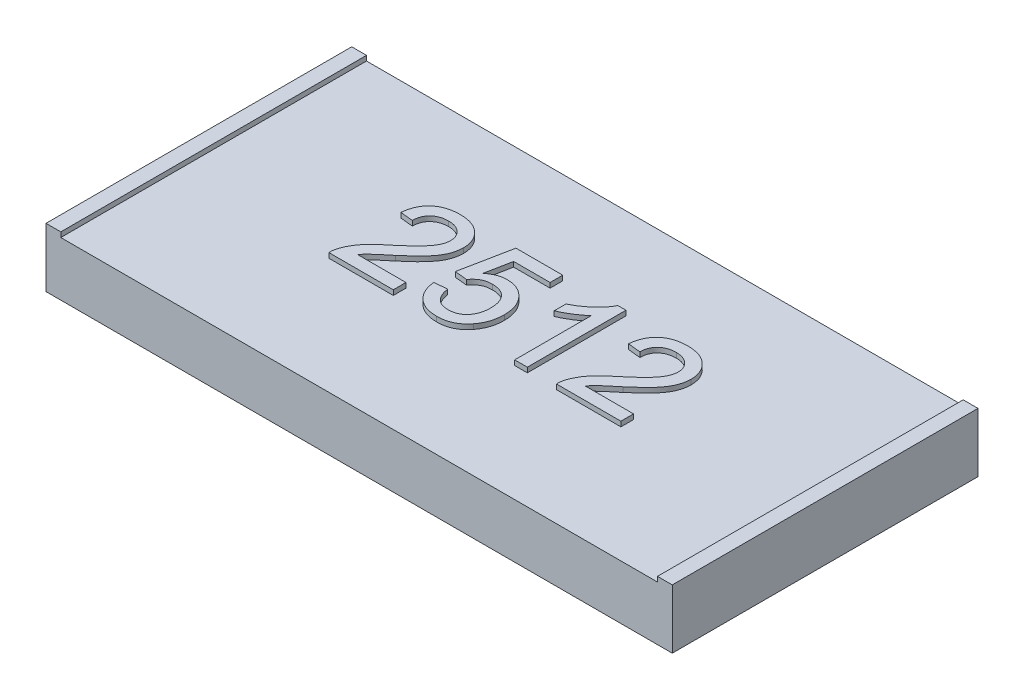
from build123d import *

# Parameters (mm, degrees)
SKETCH_1_W      = 6.35
SKETCH_1_H      = 3.1
EXTRUDE_1_DEPTH = 0.55
SKETCH_2_W      = 0.15
SKETCH_2_H      = 3.1
EXTRUDE_2_DEPTH = 0.05
EXTRUDE_3_DEPTH = 0.05


with BuildPart() as part:
    # Эскиз1 → Бобышка-Вытянуть1 (new body)
    with BuildSketch(Plane(origin=(0, 0, 0), x_dir=(1, 0, 0), z_dir=(0, 1, 0))):
        Rectangle(SKETCH_1_W, SKETCH_1_H)
    extrude(amount=EXTRUDE_1_DEPTH)

    # Эскиз2 → Бобышка-Вытянуть2 (add)
    with BuildSketch(Plane(origin=(0, 0.55, 0), x_dir=(1, 0, 0), z_dir=(0, 1, 0))):
        with Locations((-3.1, 0)):
            Rectangle(SKETCH_2_W, SKETCH_2_H)
        with Locations((3.1, 0)):
            Rectangle(SKETCH_2_W, SKETCH_2_H)
    extrude(amount=EXTRUDE_2_DEPTH)

    # Эскиз3 → Бобышка-Вытянуть3 (add)
    with BuildSketch(Plane(origin=(0, 0.55, 0), x_dir=(1, 0, 0), z_dir=(0, 1, 0))):
        with BuildLine():
            Line((-0.830578311, -0.244666445), (-0.830578311, -0.372871573))
            Line((-0.830578311, -0.372871573), (-1.484424464, -0.372871573))
            add(Edge.make_bspline(
                [(-1.484424464, -0.372871573), (-1.48443785, -0.365251982), (-1.484464577, -0.350038338), (-1.481890184, -0.327538325), (-1.477858168, -0.305336793), (-1.47329917, -0.291099834), (-1.47100299, -0.283929265)],
                knots=[0, 0, 0, 0, 1.01057331, 2.01775941, 3.001627217, 4, 4, 4, 4], degree=3))
            add(Edge.make_bspline(
                [(-1.47100299, -0.283929265), (-1.466760414, -0.272213411), (-1.458121831, -0.248358003), (-1.440619972, -0.21393798), (-1.420033649, -0.179726122), (-1.399989965, -0.15187284), (-1.38163428, -0.129620014), (-1.366240645, -0.112209754), (-1.349181676, -0.094388301), (-1.330471033, -0.07615891), (-1.310288797, -0.057403518), (-1.288607427, -0.038059575), (-1.265170902, -0.018487577), (-1.248809755, -0.005514443), (-1.24043408, 0.001126825)],
                knots=[0, 0, 0, 0, 1.204657718, 2.452881516, 3.728232997, 5.065887527, 5.768225529, 6.518857853, 7.313994055, 8.154655305, 9.046094665, 9.979688118, 10.965752482, 12, 12, 12, 12], degree=3))
            add(Edge.make_bspline(
                [(-1.24043408, 0.001126825), (-1.227566974, 0.011956859), (-1.202790545, 0.032810776), (-1.167802346, 0.063756057), (-1.135846321, 0.092490504), (-1.107431333, 0.119517745), (-1.082324979, 0.144575635), (-1.060468308, 0.167607401), (-1.041673258, 0.188541166), (-1.02616928, 0.208134644), (-1.013088098, 0.226636337), (-1.002002952, 0.244683596), (-0.992764953, 0.262591667), (-0.985070936, 0.280303884), (-0.978985623, 0.297895992), (-0.974837616, 0.315419246), (-0.972024581, 0.332699771), (-0.971743135, 0.344198425), (-0.971603952, 0.349884837)],
                knots=[0, 0, 0, 0, 1.782554561, 3.432421876, 4.950675607, 6.337395053, 7.588547463, 8.709982106, 9.702713005, 10.569305638, 11.356701089, 12.103210377, 12.812277205, 13.490692607, 14.148717897, 14.782152033, 15.397739362, 16, 16, 16, 16], degree=3))
            add(Edge.make_bspline(
                [(-0.971603952, 0.349884837), (-0.971743152, 0.355504903), (-0.972016255, 0.366531165), (-0.974607441, 0.38266803), (-0.978214581, 0.398208218), (-0.984046228, 0.412871969), (-0.990987644, 0.427093535), (-0.999891685, 0.440423533), (-1.01019183, 0.453194179), (-1.021984624, 0.465068773), (-1.034865118, 0.476209038), (-1.049257233, 0.485469304), (-1.064215701, 0.493806303), (-1.080256575, 0.500509728), (-1.097353791, 0.505432173), (-1.115382888, 0.5090046), (-1.134341005, 0.511269711), (-1.147278588, 0.511583382), (-1.153895618, 0.511743812)],
                knots=[0, 0, 0, 0, 0.988194508, 1.938783882, 2.870742509, 3.789494954, 4.709148727, 5.651055405, 6.603531303, 7.592354411, 8.592907906, 9.593461401, 10.59787167, 11.603930315, 12.645063138, 13.723588815, 14.835711238, 16, 16, 16, 16], degree=3))
            add(Edge.make_bspline(
                [(-1.153895618, 0.511743812), (-1.160846625, 0.511584177), (-1.174450255, 0.511271759), (-1.19433512, 0.508997615), (-1.213212352, 0.50552303), (-1.231036895, 0.500210688), (-1.247787053, 0.493518441), (-1.263394608, 0.485094684), (-1.278109501, 0.475585787), (-1.291468303, 0.464327969), (-1.303548492, 0.451845346), (-1.314272888, 0.438255545), (-1.323059919, 0.423296312), (-1.330316612, 0.407296566), (-1.3361516, 0.390206011), (-1.340387603, 0.371893993), (-1.3426971, 0.352413384), (-1.343161521, 0.339073068), (-1.343398823, 0.332256632)],
                knots=[0, 0, 0, 0, 1.131143733, 2.213731411, 3.253917892, 4.251203413, 5.236093891, 6.184197493, 7.13373276, 8.082770301, 9.020476205, 9.957489029, 10.893177274, 11.836722509, 12.812818608, 13.827831385, 14.890097571, 16, 16, 16, 16], degree=3))
            Line((-1.343398823, 0.332256632), (-1.471603952, 0.345077145))
            add(Edge.make_bspline(
                [(-1.471603952, 0.345077145), (-1.470292231, 0.356250535), (-1.467740392, 0.377987404), (-1.461384107, 0.409469597), (-1.45246046, 0.438757061), (-1.441782562, 0.466258125), (-1.428396812, 0.491504637), (-1.413265373, 0.515018794), (-1.395418539, 0.536054824), (-1.375702522, 0.555275814), (-1.353901312, 0.572214564), (-1.330219698, 0.587012914), (-1.304668512, 0.59939082), (-1.277390065, 0.60963921), (-1.248321733, 0.617414922), (-1.217504638, 0.62299084), (-1.18488922, 0.626427901), (-1.162517908, 0.626891586), (-1.151091131, 0.627128427)],
                knots=[0, 0, 0, 0, 1.130804643, 2.199883102, 3.223565206, 4.205909148, 5.160801384, 6.091796021, 7.01151579, 7.927798993, 8.855738875, 9.7815393, 10.730299821, 11.705391175, 12.706931101, 13.751121791, 14.851322166, 16, 16, 16, 16], degree=3))
            add(Edge.make_bspline(
                [(-1.151091131, 0.627128427), (-1.139527582, 0.626930414), (-1.117001719, 0.626544685), (-1.084177917, 0.622597894), (-1.053207753, 0.616450803), (-1.02397769, 0.607883641), (-0.996660425, 0.596649536), (-0.971234943, 0.582923997), (-0.947584014, 0.566840912), (-0.926102795, 0.548207214), (-0.906732619, 0.527865411), (-0.889757515, 0.506156322), (-0.875565512, 0.48317269), (-0.863481902, 0.459227795), (-0.854519043, 0.433815699), (-0.848216195, 0.407281885), (-0.843933227, 0.379603676), (-0.843579326, 0.360718772), (-0.843398823, 0.35108676)],
                knots=[0, 0, 0, 0, 1.195390245, 2.328627238, 3.413424916, 4.457841177, 5.473507151, 6.462241215, 7.441013641, 8.425227782, 9.397253344, 10.342087291, 11.269524934, 12.186751184, 13.110685745, 14.048630397, 15.004728144, 16, 16, 16, 16], degree=3))
            add(Edge.make_bspline(
                [(-0.843398823, 0.35108676), (-0.843674448, 0.34119096), (-0.844226306, 0.321377521), (-0.848533627, 0.291762274), (-0.855903502, 0.262468417), (-0.865673989, 0.233139428), (-0.879022508, 0.203658901), (-0.895886095, 0.173620152), (-0.916807217, 0.142912219), (-0.936927471, 0.116807065), (-0.955656162, 0.094924362), (-0.972257377, 0.07691362), (-0.991464021, 0.05777841), (-1.012555582, 0.036856037), (-1.036392276, 0.014889079), (-1.062289217, -0.008780277), (-1.090813304, -0.033529144), (-1.110614579, -0.050436382), (-1.120842734, -0.05916965)],
                knots=[0, 0, 0, 0, 0.927118007, 1.856282007, 2.79721255, 3.754929441, 4.749232485, 5.824981375, 6.979078785, 8.228161913, 8.911614355, 9.677694854, 10.522803217, 11.452009355, 12.461436787, 13.560019032, 14.739651695, 16, 16, 16, 16], degree=3))
            add(Edge.make_bspline(
                [(-1.120842734, -0.05916965), (-1.129601603, -0.066300304), (-1.14630342, -0.079897363), (-1.17006499, -0.099609383), (-1.191348129, -0.117684772), (-1.21065054, -0.133533945), (-1.227269243, -0.147923505), (-1.241789607, -0.160223253), (-1.2536841, -0.171051616), (-1.271797307, -0.187500117), (-1.294739229, -0.210945794), (-1.311643819, -0.233727303), (-1.319761003, -0.244666445)],
                knots=[0, 0, 0, 0, 1.241996727, 2.368296581, 3.394949853, 4.3125351, 5.114548721, 5.812230366, 6.404953749, 6.883082049, 8.503329734, 10, 10, 10, 10], degree=3))
            Line((-1.319761003, -0.244666445), (-0.830578311, -0.244666445))
        make_face()
        with BuildLine():
            Line((-0.68955267, -0.103640804), (-0.561347541, -0.090820291))
            add(Edge.make_bspline(
                [(-0.561347541, -0.090820291), (-0.560078109, -0.098043946), (-0.557608867, -0.112095079), (-0.552903452, -0.132434511), (-0.546792457, -0.151330412), (-0.539926082, -0.168946431), (-0.531764236, -0.185096301), (-0.522920809, -0.200035019), (-0.512491794, -0.213232309), (-0.501527086, -0.2253784), (-0.48949248, -0.236081254), (-0.476271852, -0.245104129), (-0.462234067, -0.252976041), (-0.447208149, -0.259421213), (-0.431171069, -0.26413874), (-0.414326937, -0.267869494), (-0.396458854, -0.269749403), (-0.384267583, -0.270119069), (-0.378054272, -0.27030747)],
                knots=[0, 0, 0, 0, 1.237781394, 2.407677316, 3.51963579, 4.58689595, 5.594855907, 6.570874, 7.510833816, 8.428091223, 9.330271693, 10.221190844, 11.124215526, 12.043132878, 12.973586933, 13.941700858, 14.950982896, 16, 16, 16, 16], degree=3))
            add(Edge.make_bspline(
                [(-0.378054272, -0.27030747), (-0.370431932, -0.270123292), (-0.355526113, -0.269763125), (-0.333840971, -0.26671697), (-0.313357598, -0.261694213), (-0.294174004, -0.254665238), (-0.276065298, -0.245923877), (-0.259632227, -0.234605406), (-0.243978767, -0.221882326), (-0.230112223, -0.206713973), (-0.217489772, -0.190200687), (-0.206595648, -0.172175733), (-0.197424335, -0.152892105), (-0.189703092, -0.132353501), (-0.184001517, -0.11044259), (-0.179807548, -0.087275935), (-0.177115188, -0.062838778), (-0.176861644, -0.046089223), (-0.176732157, -0.037535034)],
                knots=[0, 0, 0, 0, 1.052816602, 2.058828735, 3.018813999, 3.961574988, 4.877590722, 5.788574389, 6.712363302, 7.658909047, 8.620312049, 9.580784896, 10.562948504, 11.56722449, 12.607883026, 13.686460295, 14.818448981, 16, 16, 16, 16], degree=3))
            add(Edge.make_bspline(
                [(-0.176732157, -0.037535034), (-0.17687933, -0.029383005), (-0.177165911, -0.013509112), (-0.179579389, 0.009605915), (-0.18365121, 0.031341036), (-0.188919765, 0.051935809), (-0.196181803, 0.071068416), (-0.20479499, 0.089016261), (-0.215346506, 0.105398439), (-0.227085764, 0.120725029), (-0.240493478, 0.1344647), (-0.255750785, 0.146066112), (-0.272259149, 0.15621969), (-0.290351067, 0.164453609), (-0.31003719, 0.170571101), (-0.331121894, 0.175277961), (-0.353823964, 0.177753576), (-0.369435361, 0.178187577), (-0.377453311, 0.178410478)],
                knots=[0, 0, 0, 0, 1.165854935, 2.270189951, 3.319242023, 4.32700288, 5.306253956, 6.24172124, 7.169108591, 8.088047231, 8.999810445, 9.905349262, 10.822648491, 11.767237767, 12.739852311, 13.766490849, 14.852878837, 16, 16, 16, 16], degree=3))
            add(Edge.make_bspline(
                [(-0.377453311, 0.178410478), (-0.387423242, 0.178118838), (-0.406543314, 0.177559539), (-0.434016892, 0.172854353), (-0.459027084, 0.165253724), (-0.481290726, 0.153925912), (-0.501182191, 0.14039298), (-0.519114712, 0.125079853), (-0.535236161, 0.107996884), (-0.544079432, 0.095135392), (-0.548527029, 0.088666889)],
                knots=[0, 0, 0, 0, 1.182877094, 2.268490576, 3.298955169, 4.273890847, 5.221533034, 6.149304476, 7.069219215, 8, 8, 8, 8], degree=3))
            Line((-0.548527029, 0.088666889), (-0.676732157, 0.101487401))
            Line((-0.676732157, 0.101487401), (-0.574168054, 0.614307914))
            Line((-0.574168054, 0.614307914), (-0.09980908, 0.614307914))
            Line((-0.09980908, 0.614307914), (-0.09980908, 0.486102786))
            Line((-0.09980908, 0.486102786), (-0.469400426, 0.486102786))
            Line((-0.469400426, 0.486102786), (-0.520281836, 0.227088363))
            add(Edge.make_bspline(
                [(-0.520281836, 0.227088363), (-0.513207821, 0.232396804), (-0.499315573, 0.242821741), (-0.477646157, 0.256471822), (-0.45566689, 0.267977931), (-0.433505721, 0.277400466), (-0.410986613, 0.284740604), (-0.388245457, 0.289840193), (-0.365204823, 0.293286796), (-0.34975472, 0.293625178), (-0.34199658, 0.293795094)],
                knots=[0, 0, 0, 0, 1.093835215, 2.148119334, 3.164235237, 4.159999629, 5.123971815, 6.089888814, 7.040853737, 8, 8, 8, 8], degree=3))
            add(Edge.make_bspline(
                [(-0.34199658, 0.293795094), (-0.331899887, 0.293530552), (-0.31201705, 0.293009606), (-0.282719001, 0.288729378), (-0.254705138, 0.281463407), (-0.227755722, 0.271677203), (-0.202226113, 0.258703919), (-0.177857714, 0.242996025), (-0.154748909, 0.224424048), (-0.133030338, 0.203338402), (-0.113330731, 0.179931117), (-0.09569894, 0.154965592), (-0.081298256, 0.127942083), (-0.069186292, 0.099566181), (-0.06005119, 0.069372085), (-0.053117328, 0.037788309), (-0.049410023, 0.004419985), (-0.048825967, -0.018296075), (-0.048527029, -0.029922855)],
                knots=[0, 0, 0, 0, 0.991958705, 1.953407265, 2.902004973, 3.832128134, 4.765371166, 5.71007953, 6.676509202, 7.674246545, 8.68000108, 9.679398714, 10.671856529, 11.683459888, 12.706765812, 13.76733029, 14.85725088, 16, 16, 16, 16], degree=3))
            add(Edge.make_bspline(
                [(-0.048527029, -0.029922855), (-0.048754028, -0.041016714), (-0.049202417, -0.062930251), (-0.052877056, -0.0952239), (-0.05893015, -0.126341372), (-0.067033573, -0.156374816), (-0.077982385, -0.185153665), (-0.091262269, -0.212770878), (-0.106581361, -0.239514631), (-0.118866477, -0.256000611), (-0.125049464, -0.264297855)],
                knots=[0, 0, 0, 0, 1.059692978, 2.093196008, 3.100373587, 4.086253034, 5.061402885, 6.037282833, 7.012182238, 8, 8, 8, 8], degree=3))
            add(Edge.make_bspline(
                [(-0.125049464, -0.264297855), (-0.132904777, -0.27398335), (-0.14835702, -0.293035759), (-0.17511241, -0.317764646), (-0.203874833, -0.338780797), (-0.234815459, -0.355854896), (-0.267726573, -0.369575381), (-0.303012479, -0.378705848), (-0.340246806, -0.384837318), (-0.365808895, -0.385403243), (-0.378855554, -0.385692086)],
                knots=[0, 0, 0, 0, 1.023140956, 2.012628108, 2.982342558, 3.942221589, 4.908720554, 5.902469194, 6.929439212, 8, 8, 8, 8], degree=3))
            add(Edge.make_bspline(
                [(-0.378855554, -0.385692086), (-0.389616978, -0.385473792), (-0.410668483, -0.385046766), (-0.441491633, -0.381334401), (-0.470808093, -0.375414488), (-0.498627048, -0.3669235), (-0.525032308, -0.356194342), (-0.549716948, -0.342564633), (-0.573109343, -0.326973095), (-0.594694937, -0.308939355), (-0.614362224, -0.288824802), (-0.631984513, -0.26705562), (-0.647323325, -0.243617613), (-0.660371258, -0.218651031), (-0.671246108, -0.192179815), (-0.679565798, -0.164023291), (-0.686155685, -0.134457717), (-0.688408469, -0.114020816), (-0.68955267, -0.103640804)],
                knots=[0, 0, 0, 0, 1.108768375, 2.168973506, 3.19473529, 4.187459816, 5.162590879, 6.12651078, 7.088512529, 8.056012598, 9.019588496, 9.983680353, 10.938070192, 11.90157236, 12.88306954, 13.882379887, 14.924449348, 16, 16, 16, 16], degree=3))
        make_face()
        with BuildLine():
            Line((0.528396048, -0.372871573), (0.40019092, -0.372871573))
            Line((0.40019092, -0.372871573), (0.40019092, 0.406375222))
            add(Edge.make_bspline(
                [(0.40019092, 0.406375222), (0.392808858, 0.399256131), (0.377466049, 0.38445988), (0.351530653, 0.36351949), (0.322583436, 0.342295518), (0.291000297, 0.321886295), (0.258806629, 0.302673214), (0.227695594, 0.285394), (0.198186604, 0.270771593), (0.178748873, 0.262776003), (0.169421689, 0.258939325)],
                knots=[0, 0, 0, 0, 0.893362401, 1.856755847, 2.901947673, 4.020460078, 5.132200827, 6.168787962, 7.121294059, 8, 8, 8, 8], degree=3))
            Line((0.169421689, 0.258939325), (0.169421689, 0.377128427))
            add(Edge.make_bspline(
                [(0.169421689, 0.377128427), (0.18544209, 0.385378966), (0.217017352, 0.401640289), (0.261626368, 0.429725829), (0.303273684, 0.46017171), (0.341269871, 0.492971193), (0.375331031, 0.526498152), (0.404034866, 0.56032817), (0.428052408, 0.593221186), (0.440102464, 0.616160416), (0.445863997, 0.627128427)],
                knots=[0, 0, 0, 0, 1.141258006, 2.249351951, 3.335817539, 4.406819942, 5.426913362, 6.360259544, 7.215985427, 8, 8, 8, 8], degree=3))
            Line((0.445863997, 0.627128427), (0.528396048, 0.627128427))
            Line((0.528396048, 0.627128427), (0.528396048, -0.372871573))
        make_face()
        with BuildLine():
            Line((1.477113997, -0.244666445), (1.477113997, -0.372871573))
            Line((1.477113997, -0.372871573), (0.823267843, -0.372871573))
            add(Edge.make_bspline(
                [(0.823267843, -0.372871573), (0.823254457, -0.365251982), (0.82322773, -0.350038338), (0.825802124, -0.327538325), (0.829834139, -0.305336793), (0.834393138, -0.291099834), (0.836689318, -0.283929265)],
                knots=[0, 0, 0, 0, 1.01057331, 2.01775941, 3.001627217, 4, 4, 4, 4], degree=3))
            add(Edge.make_bspline(
                [(0.836689318, -0.283929265), (0.840931893, -0.272213411), (0.849570476, -0.248358003), (0.867072336, -0.21393798), (0.887658659, -0.179726122), (0.907702342, -0.15187284), (0.926058028, -0.129620014), (0.941451663, -0.112209754), (0.958510632, -0.094388301), (0.977221275, -0.07615891), (0.997403511, -0.057403518), (1.01908488, -0.038059575), (1.042521405, -0.018487577), (1.058882553, -0.005514443), (1.067258228, 0.001126825)],
                knots=[0, 0, 0, 0, 1.204657718, 2.452881516, 3.728232997, 5.065887527, 5.768225529, 6.518857853, 7.313994055, 8.154655305, 9.046094665, 9.979688118, 10.965752482, 12, 12, 12, 12], degree=3))
            add(Edge.make_bspline(
                [(1.067258228, 0.001126825), (1.080125334, 0.011956859), (1.104901762, 0.032810776), (1.139889962, 0.063756057), (1.171845987, 0.092490504), (1.200260975, 0.119517745), (1.225367329, 0.144575635), (1.247224, 0.167607401), (1.26601905, 0.188541166), (1.281523028, 0.208134644), (1.29460421, 0.226636337), (1.305689356, 0.244683596), (1.314927355, 0.262591667), (1.322621371, 0.280303884), (1.328706685, 0.297895992), (1.332854692, 0.315419246), (1.335667726, 0.332699771), (1.335949173, 0.344198425), (1.336088356, 0.349884837)],
                knots=[0, 0, 0, 0, 1.782554561, 3.432421876, 4.950675607, 6.337395053, 7.588547463, 8.709982106, 9.702713005, 10.569305638, 11.356701089, 12.103210377, 12.812277205, 13.490692607, 14.148717897, 14.782152033, 15.397739362, 16, 16, 16, 16], degree=3))
            add(Edge.make_bspline(
                [(1.336088356, 0.349884837), (1.335949156, 0.355504903), (1.335676053, 0.366531165), (1.333084866, 0.38266803), (1.329477727, 0.398208218), (1.323646079, 0.412871969), (1.316704664, 0.427093535), (1.307800623, 0.440423533), (1.297500478, 0.453194179), (1.285707683, 0.465068773), (1.27282719, 0.476209038), (1.258435075, 0.485469304), (1.243476607, 0.493806303), (1.227435733, 0.500509728), (1.210338517, 0.505432173), (1.19230942, 0.5090046), (1.173351302, 0.511269711), (1.16041372, 0.511583382), (1.153796689, 0.511743812)],
                knots=[0, 0, 0, 0, 0.988194508, 1.938783882, 2.870742509, 3.789494954, 4.709148727, 5.651055405, 6.603531303, 7.592354411, 8.592907906, 9.593461401, 10.59787167, 11.603930315, 12.645063138, 13.723588815, 14.835711238, 16, 16, 16, 16], degree=3))
            add(Edge.make_bspline(
                [(1.153796689, 0.511743812), (1.146845683, 0.511584177), (1.133242052, 0.511271759), (1.113357188, 0.508997615), (1.094479955, 0.50552303), (1.076655413, 0.500210688), (1.059905254, 0.493518441), (1.0442977, 0.485094684), (1.029582807, 0.475585787), (1.016224005, 0.464327969), (1.004143816, 0.451845346), (0.99341942, 0.438255545), (0.984632389, 0.423296312), (0.977375696, 0.407296566), (0.971540708, 0.390206011), (0.967304705, 0.371893993), (0.964995208, 0.352413384), (0.964530787, 0.339073068), (0.964293484, 0.332256632)],
                knots=[0, 0, 0, 0, 1.131143733, 2.213731411, 3.253917892, 4.251203413, 5.236093891, 6.184197493, 7.13373276, 8.082770301, 9.020476205, 9.957489029, 10.893177274, 11.836722509, 12.812818608, 13.827831385, 14.890097571, 16, 16, 16, 16], degree=3))
            Line((0.964293484, 0.332256632), (0.836088356, 0.345077145))
            add(Edge.make_bspline(
                [(0.836088356, 0.345077145), (0.837400077, 0.356250535), (0.839951916, 0.377987404), (0.8463082, 0.409469597), (0.855231848, 0.438757061), (0.865909745, 0.466258125), (0.879295496, 0.491504637), (0.894426935, 0.515018794), (0.912273769, 0.536054824), (0.931989785, 0.555275814), (0.953790995, 0.572214564), (0.97747261, 0.587012914), (1.003023796, 0.59939082), (1.030302242, 0.60963921), (1.059370574, 0.617414922), (1.09018767, 0.62299084), (1.122803087, 0.626427901), (1.145174399, 0.626891586), (1.156601177, 0.627128427)],
                knots=[0, 0, 0, 0, 1.130804643, 2.199883102, 3.223565206, 4.205909148, 5.160801384, 6.091796021, 7.01151579, 7.927798993, 8.855738875, 9.7815393, 10.730299821, 11.705391175, 12.706931101, 13.751121791, 14.851322166, 16, 16, 16, 16], degree=3))
            add(Edge.make_bspline(
                [(1.156601177, 0.627128427), (1.168164726, 0.626930414), (1.190690588, 0.626544685), (1.223514391, 0.622597894), (1.254484555, 0.616450803), (1.283714618, 0.607883641), (1.311031883, 0.596649536), (1.336457365, 0.582923997), (1.360108294, 0.566840912), (1.381589513, 0.548207214), (1.400959689, 0.527865411), (1.417934792, 0.506156322), (1.432126796, 0.48317269), (1.444210406, 0.459227795), (1.453173265, 0.433815699), (1.459476113, 0.407281885), (1.463759081, 0.379603676), (1.464112982, 0.360718772), (1.464293484, 0.35108676)],
                knots=[0, 0, 0, 0, 1.195390245, 2.328627238, 3.413424916, 4.457841177, 5.473507151, 6.462241215, 7.441013641, 8.425227782, 9.397253344, 10.342087291, 11.269524934, 12.186751184, 13.110685745, 14.048630397, 15.004728144, 16, 16, 16, 16], degree=3))
            add(Edge.make_bspline(
                [(1.464293484, 0.35108676), (1.46401786, 0.34119096), (1.463466002, 0.321377521), (1.459158681, 0.291762274), (1.451788806, 0.262468417), (1.442018319, 0.233139428), (1.4286698, 0.203658901), (1.411806213, 0.173620152), (1.39088509, 0.142912219), (1.370764836, 0.116807065), (1.352036146, 0.094924362), (1.335434931, 0.07691362), (1.316228286, 0.05777841), (1.295136725, 0.036856037), (1.271300032, 0.014889079), (1.24540309, -0.008780277), (1.216879004, -0.033529144), (1.197077729, -0.050436382), (1.186849574, -0.05916965)],
                knots=[0, 0, 0, 0, 0.927118007, 1.856282007, 2.79721255, 3.754929441, 4.749232485, 5.824981375, 6.979078785, 8.228161913, 8.911614355, 9.677694854, 10.522803217, 11.452009355, 12.461436787, 13.560019032, 14.739651695, 16, 16, 16, 16], degree=3))
            add(Edge.make_bspline(
                [(1.186849574, -0.05916965), (1.178090704, -0.066300304), (1.161388888, -0.079897363), (1.137627318, -0.099609383), (1.116344179, -0.117684772), (1.097041768, -0.133533945), (1.080423065, -0.147923505), (1.065902701, -0.160223253), (1.054008208, -0.171051616), (1.035895001, -0.187500117), (1.012953078, -0.210945794), (0.996048489, -0.233727303), (0.987931305, -0.244666445)],
                knots=[0, 0, 0, 0, 1.241996727, 2.368296581, 3.394949853, 4.3125351, 5.114548721, 5.812230366, 6.404953749, 6.883082049, 8.503329734, 10, 10, 10, 10], degree=3))
            Line((0.987931305, -0.244666445), (1.477113997, -0.244666445))
        make_face()
    extrude(amount=EXTRUDE_3_DEPTH)


solid = part.part
